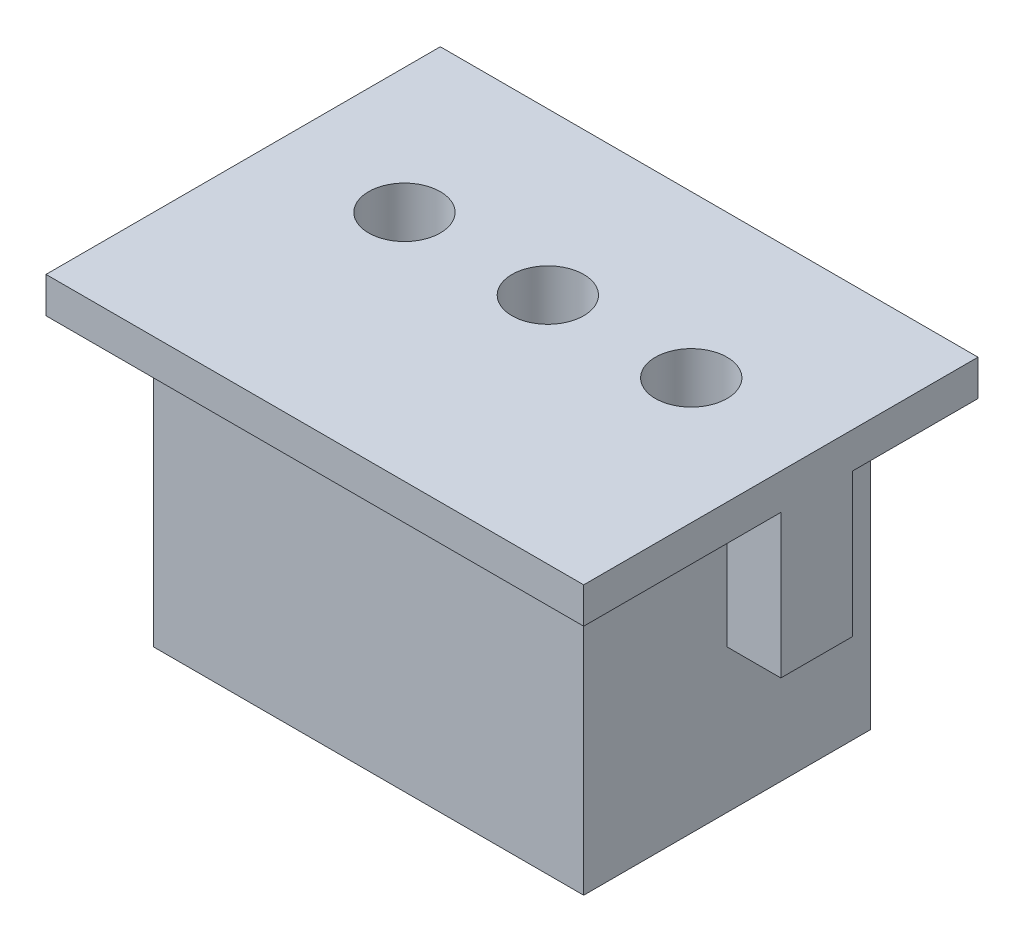
from build123d import *

# Parameters (mm, degrees)
SKETCH1_W           = 6
SKETCH1_H           = 4
BOSS_EXTRUDE1_DEPTH = 4
SKETCH2_W           = 1
SKETCH2_H           = 2
BOSS_EXTRUDE2_DEPTH = 0.75
SKETCH3_W           = 7.5
SKETCH3_H           = 5.5
BOSS_EXTRUDE3_DEPTH = 0.5
SKETCH4_R           = 0.5
CUT_EXTRUDE1_DEPTH  = 7.471089553


with BuildPart() as part:
    # Sketch1 → Boss-Extrude1 (new body)
    with BuildSketch(Plane(origin=(0, 0, 0), x_dir=(1, 0, 0), z_dir=(0, 1, 0))):
        Rectangle(SKETCH1_W, SKETCH1_H)
    extrude(amount=BOSS_EXTRUDE1_DEPTH)

    # Sketch2 → Boss-Extrude2 (add)
    with BuildSketch(Plane(origin=(3, 0, 0), x_dir=(0, 0, -1), z_dir=(1, 0, 0))):
        with Locations((0.5, 3)):
            Rectangle(SKETCH2_W, SKETCH2_H)
    boss_extrude2 = extrude(amount=BOSS_EXTRUDE2_DEPTH)

    # Mirror1: Boss-Extrude2 across plane
    add(boss_extrude2.mirror(Plane(origin=(0, 0, 0), x_dir=(0, 0, 1), z_dir=(1, 0, 0))))

    # Sketch3 → Boss-Extrude3 (add)
    with BuildSketch(Plane(origin=(0, 4, 0), x_dir=(1, 0, 0), z_dir=(0, 1, 0))):
        Rectangle(SKETCH3_W, SKETCH3_H)
    extrude(amount=BOSS_EXTRUDE3_DEPTH)

    # Sketch4 → Cut-Extrude1 (cut, through all)
    with BuildSketch(Plane.XZ):
        with Locations(Location((-2, -0.5, 0), (0, 0, 270))):
            Circle(SKETCH4_R)
        with Locations(Location((0, -0.5, 0), (0, 0, 270))):
            Circle(SKETCH4_R)
        with Locations(Location((2, -0.5, 0), (0, 0, 270))):
            Circle(SKETCH4_R)
    extrude(amount=-CUT_EXTRUDE1_DEPTH, mode=Mode.SUBTRACT)


solid = part.part
